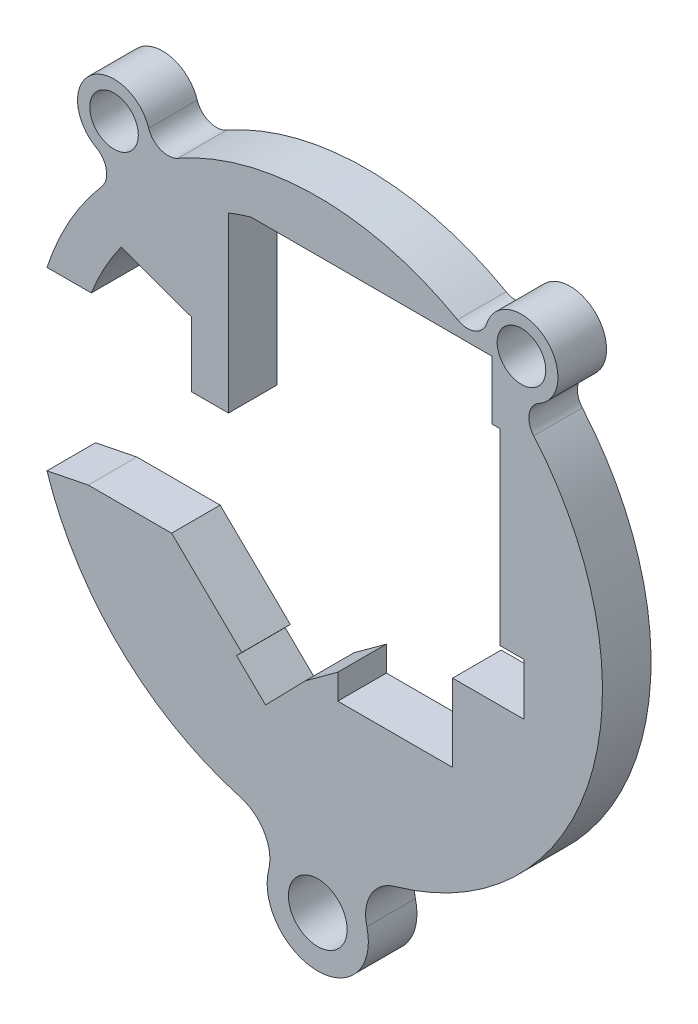
from build123d import *

# Parameters (mm, degrees)
SKETCH1_R           = 1.4224
BOSS_EXTRUDE1_DEPTH = 3.048
CUT_EXTRUDE1_DEPTH  = 31.684629768
SKETCH3_R           = 21.59
SKETCH3_R_2         = 17.859965052
CUT_EXTRUDE2_DEPTH  = 31.684629768
SKETCH4_R           = 1.524
SKETCH4_R_2         = 1.8415
BOSS_EXTRUDE3_DEPTH = 3.048
SKETCH7_W           = 0.508
SKETCH7_H           = 3.683
BOSS_EXTRUDE4_DEPTH = 3.048


with BuildPart() as part:
    # Sketch1 → Boss-Extrude1 (new body)
    with BuildSketch(Plane.XY):
        with BuildLine():
            Line((-14.952058744, -2.948480848), (-16.984058744, -2.948480848))
            Line((-16.984058744, -2.948480848), (-16.984058744, -5.5245))
            Line((-16.984058744, -5.5245), (-20.871224203, -5.5245))
            ThreePointArc((-20.871224203, -5.5245), (21.59, 0), (-20.871224203, 5.5245))
            Line((-20.871224203, 5.5245), (-16.984058744, 5.5245))
            Line((-16.984058744, 5.5245), (-16.984058744, 2.948480848))
            Line((-16.984058744, 2.948480848), (-14.952058744, 2.948480848))
            ThreePointArc((-14.952058744, 2.948480848), (-13.968818521, 6.093415226), (-12.332576282, 8.9535))
            Line((-12.332576282, 8.9535), (-7.9248, 7.366))
            Line((-7.9248, 7.366), (-7.9248, 3.302))
            Line((-7.9248, 3.302), (-5.6007, 3.302))
            Line((-5.6007, 3.302), (-5.6007, 14.173558463))
            ThreePointArc((-5.6007, 14.173558463), (-4.895856129, 14.43219293), (-4.179129857, 14.6558))
            Line((-4.179129857, 14.6558), (4.179129857, 14.6558))
            Line((4.179129857, 14.6558), (11.43, 14.6558))
            Line((11.43, 14.6558), (11.43, -0.8128))
            Line((11.43, -0.8128), (12.9413, -0.8128))
            Line((12.9413, -0.8128), (12.9413, -4.064))
            Line((12.9413, -4.064), (8.4582, -4.064))
            Line((8.4582, -4.064), (8.4582, -8.9154))
            Line((8.4582, -8.9154), (1.2573, -8.9154))
            Line((1.2573, -8.9154), (1.2573, -7.3406))
            Line((1.2573, -7.3406), (-0.7747, -8.8265))
            Line((-0.7747, -8.8265), (-3.273729572, -11.3919))
            Line((-3.273729572, -11.3919), (-5.093162196, -9.619538602))
            Line((-5.093162196, -9.619538602), (-4.769706241, -9.287492148))
            Line((-4.769706241, -9.287492148), (-9.167166743, -5.0038))
            Line((-9.167166743, -5.0038), (-14.395123673, -5.0038))
            ThreePointArc((-14.395123673, -5.0038), (-14.709533071, -3.985879682), (-14.952058744, -2.948480848))
        make_face()
        with Locations(Location((0, 18.415, 0), (0, 0, 180))):
            Circle(SKETCH1_R, mode=Mode.SUBTRACT)
        with Locations(Location((0, -18.415, 0), (0, 0, 180))):
            Circle(SKETCH1_R, mode=Mode.SUBTRACT)
    extrude(amount=BOSS_EXTRUDE1_DEPTH)

    # Sketch2 → Cut-Extrude1 (cut, through all)
    with BuildSketch(Plane.XY.offset(3.048)):
        Polygon((-14.395123673, -5.0038), (-16.984058744, -5.5245), (-16.984058744, 5.5245), (-14.203432675, 5.5245), align=None)
    extrude(amount=-CUT_EXTRUDE1_DEPTH, mode=Mode.SUBTRACT)

    # Sketch3 → Cut-Extrude2 (cut, through all)
    with BuildSketch(Plane.XY.offset(3.048)):
        Circle(SKETCH3_R)
        Circle(SKETCH3_R_2, mode=Mode.SUBTRACT)
    extrude(amount=-CUT_EXTRUDE2_DEPTH, mode=Mode.SUBTRACT)


with BuildPart() as cut_extrude2_piece_1:
    # of the separate pieces the step leaves, piece 1, a body of its own (cut_extrude2_pieces)
    add(part.part.solids().sort_by_distance((-14.395123673, -5.0038, 0))[0])



with BuildPart() as cut_extrude2_piece_2:
    # of the separate pieces the step leaves, piece 2, a body of its own (cut_extrude2_pieces)
    add(part.part.solids().sort_by_distance((-16.984058744, 5.5245, 0))[0])


with BuildPart() as cut_extrude2_piece_1_1:
    add(cut_extrude2_piece_1.part)

    add(cut_extrude2_piece_2.part)  # Boss-Extrude3 merges Cut-Extrude2 piece 2
    # Sketch4 → Boss-Extrude3 (add)
    # profile 1 of 4: a face of its own
    with BuildSketch(Plane.XY.offset(3.048)):
        with BuildLine():
            ThreePointArc((8.770915547, 15.557936629), (9.49974685, 15.123926787), (10.207148379, 14.6558))
            Line((10.207148379, 14.6558), (11.43, 14.6558))
            Line((11.43, 14.6558), (11.43, 13.723463545))
            ThreePointArc((11.43, 13.723463545), (12.531489365, 12.72556977), (13.546192441, 11.639545611))
            ThreePointArc((13.546192441, 11.639545611), (13.259158271, 12.690113644), (13.891550536, 13.576771317))
            ThreePointArc((13.891550536, 13.576771317), (14.229434963, 17.341171724), (10.603438482, 16.274857592))
            ThreePointArc((10.603438482, 16.274857592), (9.857305907, 15.481530348), (8.770915547, 15.557936629))
        make_face()
        with Locations((12.779339593, 15.573965052)):
            Circle(SKETCH4_R, mode=Mode.SUBTRACT)
    # profile 2 of 4: a face of its own
    with BuildSketch(Plane.XY.offset(3.048)):
        with BuildLine():
            ThreePointArc((-1.288911844, 17.813395463), (0, 16.9926), (1.288911844, 17.813395463))
            ThreePointArc((1.288911844, 17.813395463), (0, 17.859965052), (-1.288911844, 17.813395463))
        make_face()
    # profile 3 of 4: a face of its own
    with BuildSketch(Plane.XY.offset(3.048)):
        with BuildLine():
            ThreePointArc((-8.770915605, 15.557936596), (-9.857305878, 15.481530337), (-10.603438442, 16.274857469))
            ThreePointArc((-10.603438442, 16.274857469), (-14.229434898, 17.341171777), (-13.891550571, 13.576771336))
            ThreePointArc((-13.891550571, 13.576771336), (-13.259158271, 12.690113644), (-13.546192467, 11.639545581))
            ThreePointArc((-13.546192467, 11.639545581), (-11.329244247, 13.806758362), (-8.770915605, 15.557936596))
        make_face()
        with Locations((-12.779339593, 15.573965052)):
            Circle(SKETCH4_R, mode=Mode.SUBTRACT)
    # profile 4 of 4: a face of its own
    with BuildSketch(Plane.XY.offset(3.048)):
        with BuildLine():
            ThreePointArc((3.078011458, -20.256202915), (3.341190672, -18.362372873), (4.85058289, -17.188664791))
            ThreePointArc((4.85058289, -17.188664791), (3.085598969, -17.591402181), (1.288911844, -17.813395463))
            ThreePointArc((1.288911844, -17.813395463), (0, -16.9926), (-1.288911844, -17.813395463))
            ThreePointArc((-1.288911844, -17.813395463), (-3.085599014, -17.591402173), (-4.850582978, -17.188664766))
            ThreePointArc((-4.850582978, -17.188664766), (-3.341190697, -18.36237283), (-3.078011456, -20.256202907))
            ThreePointArc((-3.078011456, -20.256202907), (-4e-09, -24.209965052), (3.078011458, -20.256202915))
        make_face()
        with Locations((0, -21.034965052)):
            Circle(SKETCH4_R_2, mode=Mode.SUBTRACT)
    extrude(amount=-BOSS_EXTRUDE3_DEPTH)

    # Sketch7 → Boss-Extrude4 (add)
    with BuildSketch(Plane.XY.offset(3.048)):
        with Locations((11.176, 12.8143)):
            Rectangle(SKETCH7_W, SKETCH7_H)
    extrude(amount=-BOSS_EXTRUDE4_DEPTH)


solid = cut_extrude2_piece_1_1.part
